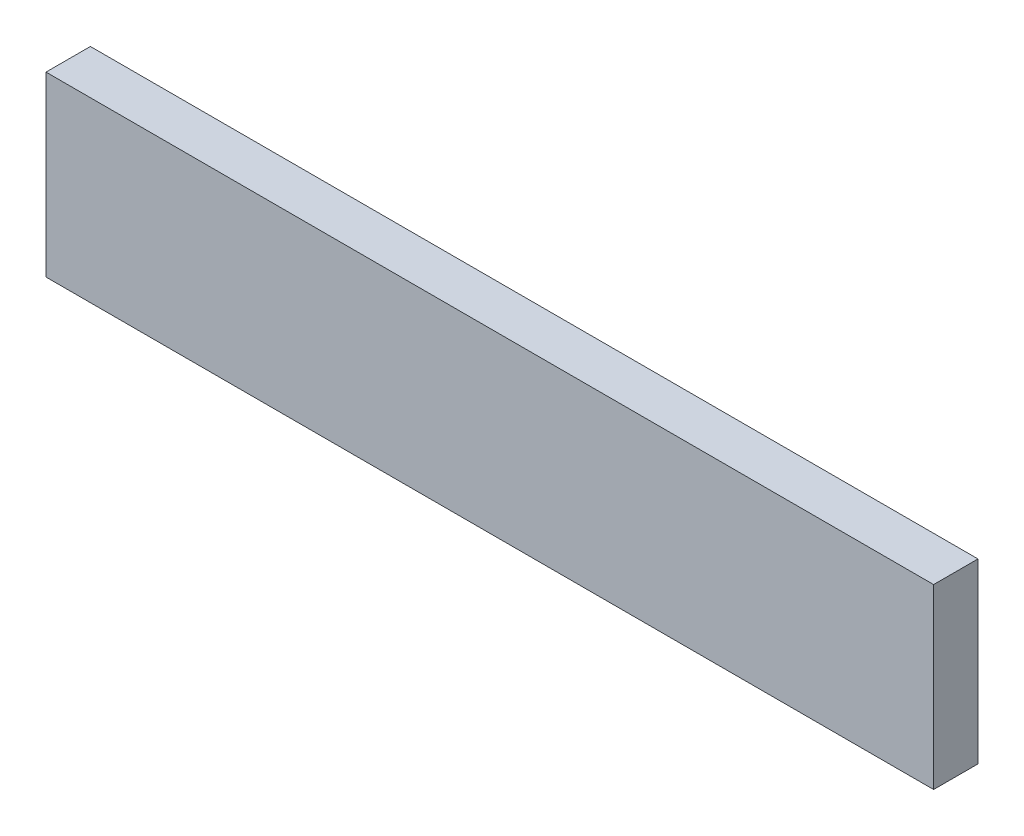
from build123d import *

# Parameters (mm, degrees)
SKETCH1_W           = 20000
SKETCH1_H           = 100000
BOSS_EXTRUDE1_DEPTH = 5000


with BuildPart() as part:
    # Sketch1 → Boss-Extrude1 (new body)
    with BuildSketch(Plane(origin=(0, 0, 0), x_dir=(0, 1, 0), z_dir=(0, 0, 1))):
        with Locations((0, -50000)):
            Rectangle(SKETCH1_W, SKETCH1_H)
    extrude(amount=BOSS_EXTRUDE1_DEPTH)


solid = part.part
